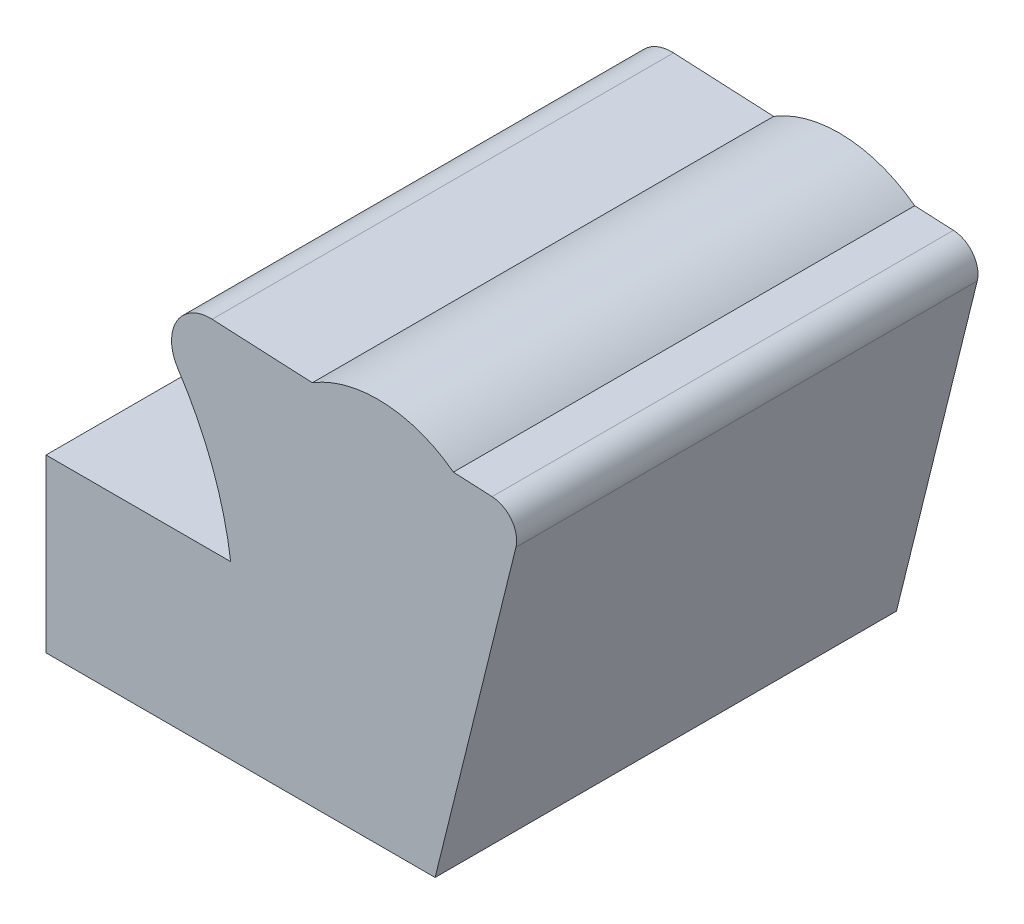
from build123d import *

# Parameters (mm, degrees)
EXTRUDE_1_DEPTH                = 50
SPLIT_BODIES_1_SURFACE_1_BACK  = 226.829
SPLIT_BODIES_1_SURFACE_1_DEPTH = 453.658
SPLIT_BODIES_1_SURFACE_2_BACK  = 226.829
SPLIT_BODIES_1_SURFACE_2_DEPTH = 453.658


with BuildPart() as part:
    # 草图2 → 凸台-拉伸1 (new, symmetric)
    with BuildSketch(Plane.XY):
        with BuildLine():
            Line((120.381757685, 47.561632043), (136.603924057, 47.561632043))
            Line((136.603924057, 47.561632043), (146.850265064, 88.947420909))
            ThreePointArc((146.850265064, 88.947420909), (104.62030332, 85.070472378), (109.988846824, 127.136838271))
            Line((109.988846824, 127.136838271), (88.280849451, 128.197534042))
            ThreePointArc((88.280849451, 128.197534042), (80.571822415, 123.964886157), (80.863683371, 115.175163571))
            ThreePointArc((80.863683371, 115.175163571), (88.300101913, 100.587398022), (92.288223879, 84.706651578))
            Line((92.288223879, 84.706651578), (52.259104564, 84.706651578))
            Line((52.259104564, 84.706651578), (52.259104564, 37.347972633))
            Line((52.259104564, 37.347972633), (26.12059868, 28.530814049))
            Line((26.12059868, 28.530814049), (0, 28.530814049))
            Line((0, 28.530814049), (0, 0))
            Line((0, 0), (140.98, 0))
            Line((140.98, 0), (131.928221984, 26.834036233))
            Line((131.928221984, 26.834036233), (115.249995775, 26.834036233))
            Line((115.249995775, 26.834036233), (120.381757685, 47.561632043))
        make_face()
        with BuildLine():
            ThreePointArc((109.988846824, 127.136838271), (104.62030332, 85.070472378), (146.850265064, 88.947420909))
            Line((146.850265064, 88.947420909), (151.231226865, 106.642475172))
            ThreePointArc((151.231226865, 106.642475172), (147.884639105, 117.258207331), (140.564064785, 125.64287253))
            Line((140.564064785, 125.64287253), (109.988846824, 127.136838271))
        make_face()
        with BuildLine():
            ThreePointArc((140.564064785, 125.64287253), (125.506724817, 131.102497099), (109.988846824, 127.136838271))
            Line((109.988846824, 127.136838271), (140.564064785, 125.64287253))
        make_face()
        with BuildLine():
            ThreePointArc((140.564064785, 125.64287253), (147.884639105, 117.258207331), (151.231226865, 106.642475172))
            Line((151.231226865, 106.642475172), (154.115877694, 118.293810031))
            ThreePointArc((154.115877694, 118.293810031), (153.172952645, 122.982290954), (148.95330104, 125.232957822))
            Line((148.95330104, 125.232957822), (140.564064785, 125.64287253))
        make_face()
    extrude(amount=EXTRUDE_1_DEPTH, both=True)


with BuildPart() as body_2:
    # Split Bodies 1: the piece behind the surface
    add(part.part)
    # Split Bodies 1 surface: a surface, the sketch's curves swept straight by 453.658 mm
    with BuildLine(Plane.XY.offset(50).offset(-SPLIT_BODIES_1_SURFACE_1_BACK), mode=Mode.PRIVATE) as split_bodies_1_surface_1_path:
        Line((120.381757685, 47.561632043), (52.259104564, 47.561632043))
    split_bodies_1_surface_1 = Shell.extrude(split_bodies_1_surface_1_path.wire(), (0 * SPLIT_BODIES_1_SURFACE_1_DEPTH, 0 * SPLIT_BODIES_1_SURFACE_1_DEPTH, 1 * SPLIT_BODIES_1_SURFACE_1_DEPTH))
    split(bisect_by=split_bodies_1_surface_1, keep=Keep.BOTTOM)


with BuildPart() as part_1:
    add(part.part)

    # Split Bodies 1: split by a surface, the side it looks to stays
    # Split Bodies 1 surface: a surface, the sketch's curves swept straight by 453.658 mm
    with BuildLine(Plane.XY.offset(50).offset(-SPLIT_BODIES_1_SURFACE_2_BACK), mode=Mode.PRIVATE) as split_bodies_1_surface_2_path:
        Line((120.381757685, 47.561632043), (52.259104564, 47.561632043))
    split_bodies_1_surface_2 = Shell.extrude(split_bodies_1_surface_2_path.wire(), (0 * SPLIT_BODIES_1_SURFACE_2_DEPTH, 0 * SPLIT_BODIES_1_SURFACE_2_DEPTH, 1 * SPLIT_BODIES_1_SURFACE_2_DEPTH))
    split(bisect_by=split_bodies_1_surface_2, keep=Keep.TOP)


solid = body_2.part
